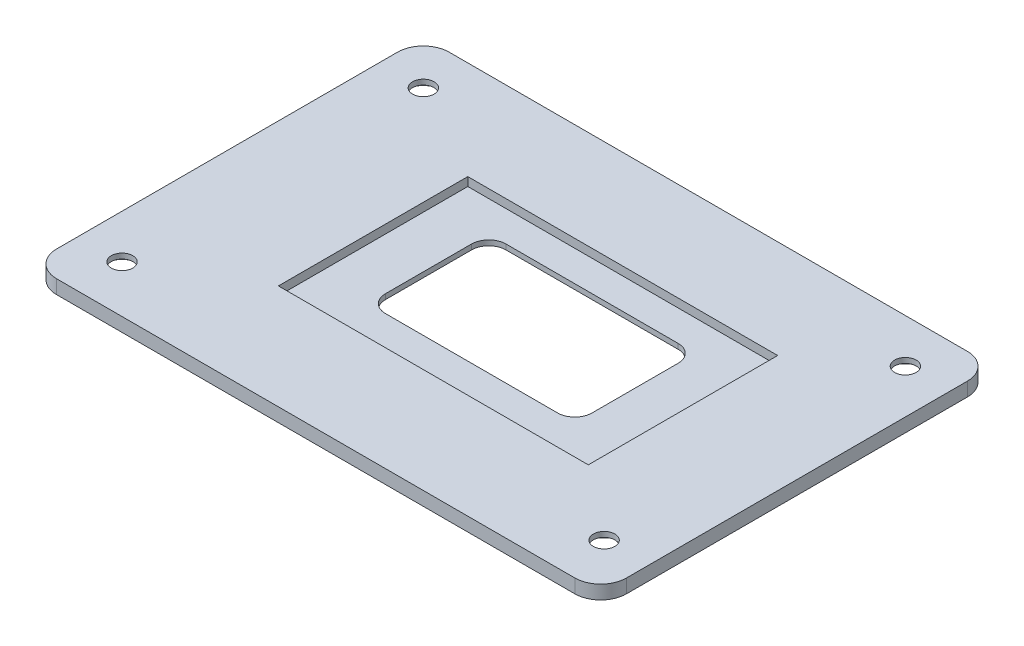
from build123d import *

# Parameters (mm, degrees)
EXTRUDE_1_DEPTH        = 1.6
CUT_EXTRUDE_827_REACH  = 42.224
SKETCH_5_R             = 2.6
CUT_EXTRUDE_1317_DEPTH = 1
CUT_EXTRUDE_1453_REACH = 42.205
SKETCH_7_R             = 1.25
SKETCH_9_W             = 36
SKETCH_9_H             = 22
CUT_EXTRUDE_2013_DEPTH = 1


with BuildPart() as part:
    # 草图1 → 凸台-拉伸1 (new body)
    with BuildSketch(Plane(origin=(0, 0, 0), x_dir=(1, 0, 0), z_dir=(0, 1, 0))):
        with BuildLine():
            Line((-30.1, -22.8), (30.1, -22.8))
            ThreePointArc((30.1, -22.8), (32.221320344, -21.921320344), (33.1, -19.8))
            Line((33.1, -19.8), (33.1, 19.8))
            ThreePointArc((33.1, 19.8), (32.221320344, 21.921320344), (30.1, 22.8))
            Line((30.1, 22.8), (-30.1, 22.8))
            ThreePointArc((-30.1, 22.8), (-32.221320344, 21.921320344), (-33.1, 19.8))
            Line((-33.1, 19.8), (-33.1, -19.8))
            ThreePointArc((-33.1, -19.8), (-32.221320344, -21.921320344), (-30.1, -22.8))
        make_face()
    extrude(amount=EXTRUDE_1_DEPTH)

    # 草图3 → Cut-Extrude 827 (cut, up to next)
    with BuildSketch(Plane(origin=(0, 1.6, 0), x_dir=(1, 0, 0), z_dir=(0, 1, 0)), mode=Mode.PRIVATE) as cut_extrude_827_sk1:
        with BuildLine():
            Line((-8.5, -6.2), (11.5, -6.2))
            ThreePointArc((11.5, -6.2), (12.914213562, -5.614213562), (13.5, -4.2))
            Line((13.5, -4.2), (13.5, 5.8))
            ThreePointArc((13.5, 5.8), (12.914213562, 7.214213562), (11.5, 7.8))
            Line((11.5, 7.8), (-8.5, 7.8))
            ThreePointArc((-8.5, 7.8), (-9.914213562, 7.214213562), (-10.5, 5.8))
            Line((-10.5, 5.8), (-10.5, -4.2))
            ThreePointArc((-10.5, -4.2), (-9.914213562, -5.614213562), (-8.5, -6.2))
        make_face()
    cut_extrude_827_tool1 = extrude(cut_extrude_827_sk1.sketch, amount=-CUT_EXTRUDE_827_REACH, mode=Mode.PRIVATE) & part.part
    add(cut_extrude_827_tool1.solids().sort_by_distance((1.5, 1.6, -0.8))[0], mode=Mode.SUBTRACT)

    # 草图5 → Cut-Extrude 1317 (cut)
    with BuildSketch(Plane.XZ):
        with Locations(Location((-28, -17.7, 0), (0, 0, 270))):
            Circle(SKETCH_5_R)
        with Locations(Location((28, -17.7, 0), (0, 0, 270))):
            Circle(SKETCH_5_R)
        with Locations(Location((28, 17.3, 0), (0, 0, 270))):
            Circle(SKETCH_5_R)
        with Locations(Location((-28, 17.3, 0), (0, 0, 270))):
            Circle(SKETCH_5_R)
    extrude(amount=-CUT_EXTRUDE_1317_DEPTH, mode=Mode.SUBTRACT)

    # 草图7 → Cut-Extrude 1453 (cut, up to next)
    with BuildSketch(Plane.XZ.offset(-1), mode=Mode.PRIVATE) as cut_extrude_1453_sk1:
        with Locations(Location((-28, -17.7, 0), (0, 0, 270))):
            Circle(SKETCH_7_R)
    cut_extrude_1453_tool1 = extrude(cut_extrude_1453_sk1.sketch, amount=-CUT_EXTRUDE_1453_REACH, mode=Mode.PRIVATE) & part.part
    # 草图7 → Cut-Extrude 1453 (cut, up to next)
    with BuildSketch(Plane.XZ.offset(-1), mode=Mode.PRIVATE) as cut_extrude_1453_sk2:
        with Locations(Location((28, -17.7, 0), (0, 0, 270))):
            Circle(SKETCH_7_R)
    cut_extrude_1453_tool2 = extrude(cut_extrude_1453_sk2.sketch, amount=-CUT_EXTRUDE_1453_REACH, mode=Mode.PRIVATE) & part.part
    # 草图7 → Cut-Extrude 1453 (cut, up to next)
    with BuildSketch(Plane.XZ.offset(-1), mode=Mode.PRIVATE) as cut_extrude_1453_sk3:
        with Locations(Location((28, 17.3, 0), (0, 0, 270))):
            Circle(SKETCH_7_R)
    cut_extrude_1453_tool3 = extrude(cut_extrude_1453_sk3.sketch, amount=-CUT_EXTRUDE_1453_REACH, mode=Mode.PRIVATE) & part.part
    # 草图7 → Cut-Extrude 1453 (cut, up to next)
    with BuildSketch(Plane.XZ.offset(-1), mode=Mode.PRIVATE) as cut_extrude_1453_sk4:
        with Locations(Location((-28, 17.3, 0), (0, 0, 270))):
            Circle(SKETCH_7_R)
    cut_extrude_1453_tool4 = extrude(cut_extrude_1453_sk4.sketch, amount=-CUT_EXTRUDE_1453_REACH, mode=Mode.PRIVATE) & part.part
    add(cut_extrude_1453_tool1.solids().sort_by_distance((-28, 1, -17.7))[0], mode=Mode.SUBTRACT)
    add(cut_extrude_1453_tool2.solids().sort_by_distance((28, 1, -17.7))[0], mode=Mode.SUBTRACT)
    add(cut_extrude_1453_tool3.solids().sort_by_distance((28, 1, 17.3))[0], mode=Mode.SUBTRACT)
    add(cut_extrude_1453_tool4.solids().sort_by_distance((-28, 1, 17.3))[0], mode=Mode.SUBTRACT)

    # 草图9 → Cut-Extrude 2013 (cut)
    with BuildSketch(Plane(origin=(0, 1.6, 0), x_dir=(1, 0, 0), z_dir=(0, 1, 0))):
        with Locations((1.500900608, 0.362797629)):
            Rectangle(SKETCH_9_W, SKETCH_9_H)
    extrude(amount=-CUT_EXTRUDE_2013_DEPTH, mode=Mode.SUBTRACT)


solid = part.part
